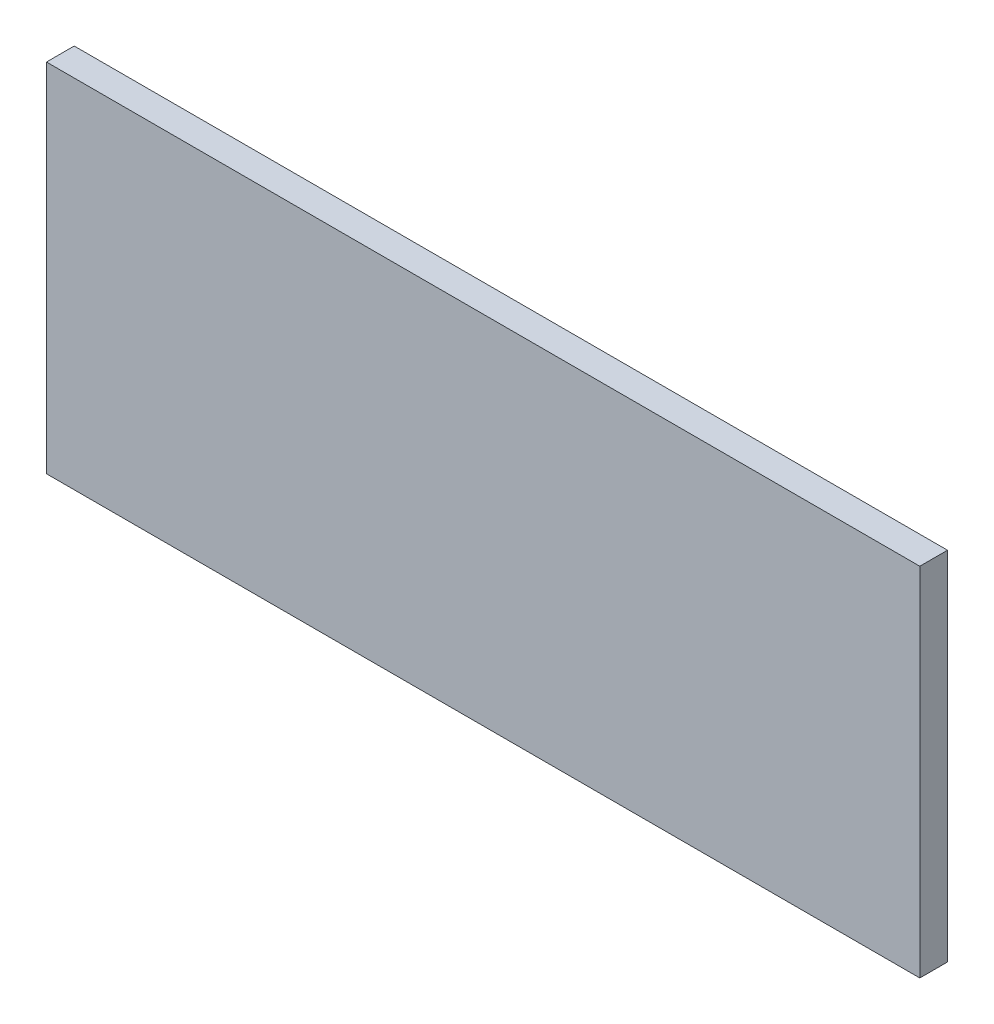
from build123d import *

# Parameters (mm, degrees)
SKETCH1_W           = 600
SKETCH1_H           = 245
BOSS_EXTRUDE1_DEPTH = 19.05


with BuildPart() as part:
    # Sketch1 → Boss-Extrude1 (new body)
    with BuildSketch(Plane.XY):
        with Locations((0, 127.5)):
            Rectangle(SKETCH1_W, SKETCH1_H)
    extrude(amount=BOSS_EXTRUDE1_DEPTH)


solid = part.part
